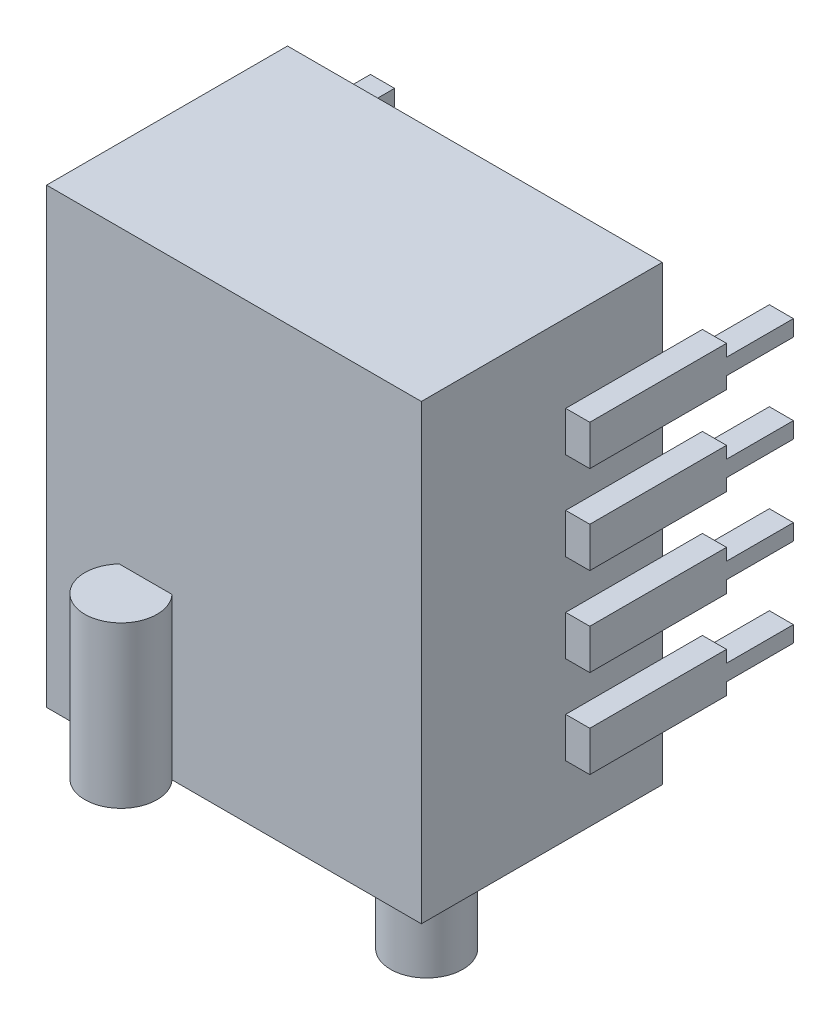
from build123d import *

# Parameters (mm, degrees)
ESQUISSE1_W          = 14
ESQUISSE1_H          = 16.9
BASE_EXTRUSION_DEPTH = 9
ESQUISSE2_R          = 1.35
BOSS_EXTRU_1_DEPTH   = 7.9
ESQUISSE3_R          = 1.35
BOSS_EXTRU_2_DEPTH   = 6
EXTRUSION1_DEPTH     = 0.9
EXTRUSION2_DEPTH     = 0.9


with BuildPart() as part:
    # Esquisse1 → Base-Extrusion (new body)
    with BuildSketch(Plane.XY):
        with Locations((7, 8.45)):
            Rectangle(ESQUISSE1_W, ESQUISSE1_H)
    extrude(amount=BASE_EXTRUSION_DEPTH)

    # Esquisse2 → Boss.-Extru.1 (add)
    with BuildSketch(Plane.XZ):
        with Locations(Location((7, 1.8, 0), (0, 0, 90))):
            Circle(ESQUISSE2_R)
    extrude(amount=BOSS_EXTRU_1_DEPTH)

    # Esquisse3 → Boss.-Extru.2 (add)
    with BuildSketch(Plane.XZ):
        with Locations((3.7, 9.921362126)):
            Circle(ESQUISSE3_R)
    extrude(amount=-BOSS_EXTRU_2_DEPTH)

    # Esquisse4 → Extrusion1 (add)
    with BuildSketch(Plane.ZY):
        Polygon((3.607457233, 13.98057371), (-1.5, 13.98057371), (-1.5, 13.53057371), (-4, 13.53057371), (-4, 12.93057371), (-1.5, 12.93057371), (-1.5, 12.48057371), (3.607457233, 12.48057371), align=None)
        Polygon((3.607457233, 10.68057371), (-1.5, 10.68057371), (-1.5, 10.23057371), (-4, 10.23057371), (-4, 9.63057371), (-1.5, 9.63057371), (-1.5, 9.18057371), (3.607457233, 9.18057371), align=None)
        Polygon((3.607457233, 7.38057371), (-1.5, 7.38057371), (-1.5, 6.93057371), (-4, 6.93057371), (-4, 6.33057371), (-1.5, 6.33057371), (-1.5, 5.88057371), (3.607457233, 5.88057371), align=None)
        Polygon((3.607457233, 4.08057371), (-1.5, 4.08057371), (-1.5, 3.63057371), (-4, 3.63057371), (-4, 3.03057371), (-1.5, 3.03057371), (-1.5, 2.58057371), (3.607457233, 2.58057371), align=None)
    extrude(amount=EXTRUSION1_DEPTH)

    # Esquisse5 → Extrusion2 (add)
    with BuildSketch(Plane(origin=(14, 0, 0), x_dir=(0, 0, -1), z_dir=(1, 0, 0))):
        Polygon((1.5, 13.98057371), (-3.607457233, 13.98057371), (-3.607457233, 12.48057371), (1.5, 12.48057371), (1.5, 12.93057371), (4, 12.93057371), (4, 13.53057371), (1.5, 13.53057371), align=None)
        Polygon((1.5, 7.38057371), (-3.607457233, 7.38057371), (-3.607457233, 5.88057371), (1.5, 5.88057371), (1.5, 6.33057371), (4, 6.33057371), (4, 6.93057371), (1.5, 6.93057371), align=None)
        Polygon((-3.607457233, 10.68057371), (-3.607457233, 9.18057371), (1.5, 9.18057371), (1.5, 9.63057371), (4, 9.63057371), (4, 10.23057371), (1.5, 10.23057371), (1.5, 10.68057371), align=None)
        Polygon((-3.607457233, 4.08057371), (-3.607457233, 2.58057371), (1.5, 2.58057371), (1.5, 3.03057371), (4, 3.03057371), (4, 3.63057371), (1.5, 3.63057371), (1.5, 4.08057371), align=None)
    extrude(amount=EXTRUSION2_DEPTH)


solid = part.part
